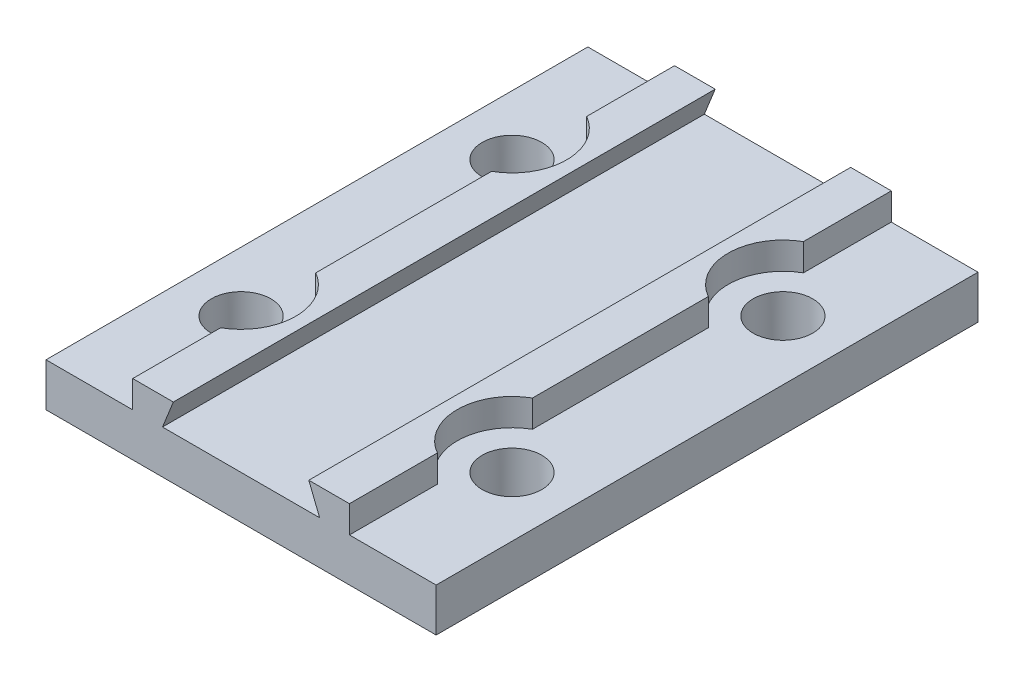
from build123d import *

# Parameters (mm, degrees)
SKETCH1_W               = 20
SKETCH1_H               = 50
BOSS_EXTRUDE1_DEPTH     = 12
CUT_EXTRUDE1_REACH      = 54.383
SKETCH4_W               = 50
SKETCH4_H               = 9.5
BOSS_EXTRUDE2_DEPTH     = 8
SKETCH5_W               = 50
SKETCH5_H               = 9.5
BOSS_EXTRUDE3_DEPTH     = 8
CUT_EXTRUDE4_DEPTH      = 33.23740064
CUT_EXTRUDE4_DEPTH_BACK = 33.23740064
SKETCH10_R              = 2.75
SKETCH13_W              = 36
SKETCH13_H              = 50
CUT_EXTRUDE6_DEPTH      = 5.5
CUT_EXTRUDE7_REACH      = 33.064
SKETCH14_R              = 5.05


with BuildPart() as part:
    # Sketch1 → Boss-Extrude1 (new body)
    with BuildSketch(Plane(origin=(0, 0, 0), x_dir=(1, 0, 0), z_dir=(0, 1, 0))):
        Rectangle(SKETCH1_W, SKETCH1_H)
    extrude(amount=BOSS_EXTRUDE1_DEPTH)

    # Sketch2 → Cut-Extrude1 (cut, up to next)
    with BuildSketch(Plane.XY.offset(25), mode=Mode.PRIVATE) as cut_extrude1_sk1:
        Polygon((0, 9.5), (7.25, 9.5), (6.25, 12), (0, 12), (-6.25, 12), (-7.25, 9.5), align=None)
    cut_extrude1_tool1 = extrude(cut_extrude1_sk1.sketch, amount=-CUT_EXTRUDE1_REACH, mode=Mode.PRIVATE) & part.part
    add(cut_extrude1_tool1.solids().sort_by_distance((0, 10.719136, 25))[0], mode=Mode.SUBTRACT)

    # Sketch4 → Boss-Extrude2 (add)
    with BuildSketch(Plane.ZY.offset(10)):
        with Locations((0, 4.75)):
            Rectangle(SKETCH4_W, SKETCH4_H)
    extrude(amount=BOSS_EXTRUDE2_DEPTH)

    # Sketch5 → Boss-Extrude3 (add)
    with BuildSketch(Plane(origin=(10, 0, 0), x_dir=(0, 0, -1), z_dir=(1, 0, 0))):
        with Locations((0, 4.75)):
            Rectangle(SKETCH5_W, SKETCH5_H)
    extrude(amount=BOSS_EXTRUDE3_DEPTH)

    # Sketch10 → Cut-Extrude4 (cut, two sides: drawn at the far end of the back side and taken through both)
    with BuildSketch(Plane(origin=(0, 9.5, 0), x_dir=(1, 0, 0), z_dir=(0, 1, 0)).offset(-CUT_EXTRUDE4_DEPTH_BACK)):
        with Locations(Location((-12.5, 12.5, 0), (0, 0, 270))):
            Circle(SKETCH10_R)
        with Locations(Location((12.5, 12.5, 0), (0, 0, 270))):
            Circle(SKETCH10_R)
        with Locations(Location((-12.5, -12.5, 0), (0, 0, 270))):
            Circle(SKETCH10_R)
        with Locations(Location((12.5, -12.5, 0), (0, 0, 270))):
            Circle(SKETCH10_R)
    extrude(amount=CUT_EXTRUDE4_DEPTH + CUT_EXTRUDE4_DEPTH_BACK, mode=Mode.SUBTRACT)

    # Sketch13 → Cut-Extrude6 (cut)
    with BuildSketch(Plane.XZ):
        Rectangle(SKETCH13_W, SKETCH13_H)
    extrude(amount=-CUT_EXTRUDE6_DEPTH, mode=Mode.SUBTRACT)

    # Sketch14 → Cut-Extrude7 (cut, up to next)
    with BuildSketch(Plane(origin=(0, 9.5, 0), x_dir=(1, 0, 0), z_dir=(0, 1, 0)), mode=Mode.PRIVATE) as cut_extrude7_sk1:
        with Locations((-12.5, 12.5)):
            Circle(SKETCH14_R)
    cut_extrude7_tool1 = extrude(cut_extrude7_sk1.sketch, amount=CUT_EXTRUDE7_REACH, mode=Mode.PRIVATE) & part.part
    # Sketch14 → Cut-Extrude7 (cut, up to next)
    with BuildSketch(Plane(origin=(0, 9.5, 0), x_dir=(1, 0, 0), z_dir=(0, 1, 0)), mode=Mode.PRIVATE) as cut_extrude7_sk2:
        with Locations((12.5, 12.5)):
            Circle(SKETCH14_R)
    cut_extrude7_tool2 = extrude(cut_extrude7_sk2.sketch, amount=CUT_EXTRUDE7_REACH, mode=Mode.PRIVATE) & part.part
    # Sketch14 → Cut-Extrude7 (cut, up to next)
    with BuildSketch(Plane(origin=(0, 9.5, 0), x_dir=(1, 0, 0), z_dir=(0, 1, 0)), mode=Mode.PRIVATE) as cut_extrude7_sk3:
        with Locations((-12.5, -12.5)):
            Circle(SKETCH14_R)
    cut_extrude7_tool3 = extrude(cut_extrude7_sk3.sketch, amount=CUT_EXTRUDE7_REACH, mode=Mode.PRIVATE) & part.part
    # Sketch14 → Cut-Extrude7 (cut, up to next)
    with BuildSketch(Plane(origin=(0, 9.5, 0), x_dir=(1, 0, 0), z_dir=(0, 1, 0)), mode=Mode.PRIVATE) as cut_extrude7_sk4:
        with Locations((12.5, -12.5)):
            Circle(SKETCH14_R)
    cut_extrude7_tool4 = extrude(cut_extrude7_sk4.sketch, amount=CUT_EXTRUDE7_REACH, mode=Mode.PRIVATE) & part.part
    add(cut_extrude7_tool1.solids().sort_by_distance((-12.5, 9.5, -12.5))[0], mode=Mode.SUBTRACT)
    add(cut_extrude7_tool2.solids().sort_by_distance((12.5, 9.5, -12.5))[0], mode=Mode.SUBTRACT)
    add(cut_extrude7_tool3.solids().sort_by_distance((-12.5, 9.5, 12.5))[0], mode=Mode.SUBTRACT)
    add(cut_extrude7_tool4.solids().sort_by_distance((12.5, 9.5, 12.5))[0], mode=Mode.SUBTRACT)


solid = part.part
